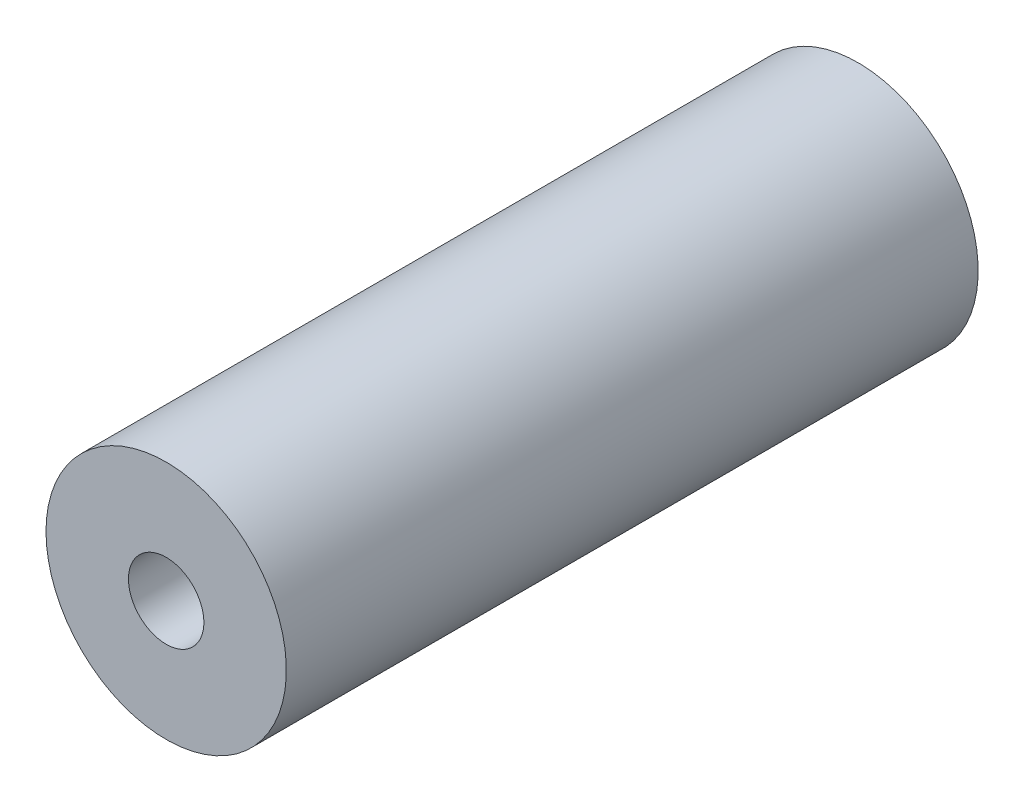
from build123d import *

# Parameters (mm, degrees)
SKETCH1_W = 45.6946
SKETCH1_H = 5.4483


with BuildPart() as part:
    # Sketch1 → Revolve1 (revolve)
    with BuildSketch(Plane(origin=(0, 0, 0), x_dir=(0, 0, -1), z_dir=(1, 0, 0)), mode=Mode.PRIVATE) as revolve1_sk:
        with Locations((0, 5.21335)):
            Rectangle(SKETCH1_W, SKETCH1_H)
    revolve(revolve1_sk.sketch.rotate(Axis((0, 0, -24.040470393), (0, 0, 1)), 90), axis=Axis((0, 0, -24.040470393), (0, 0, 1)))


solid = part.part
